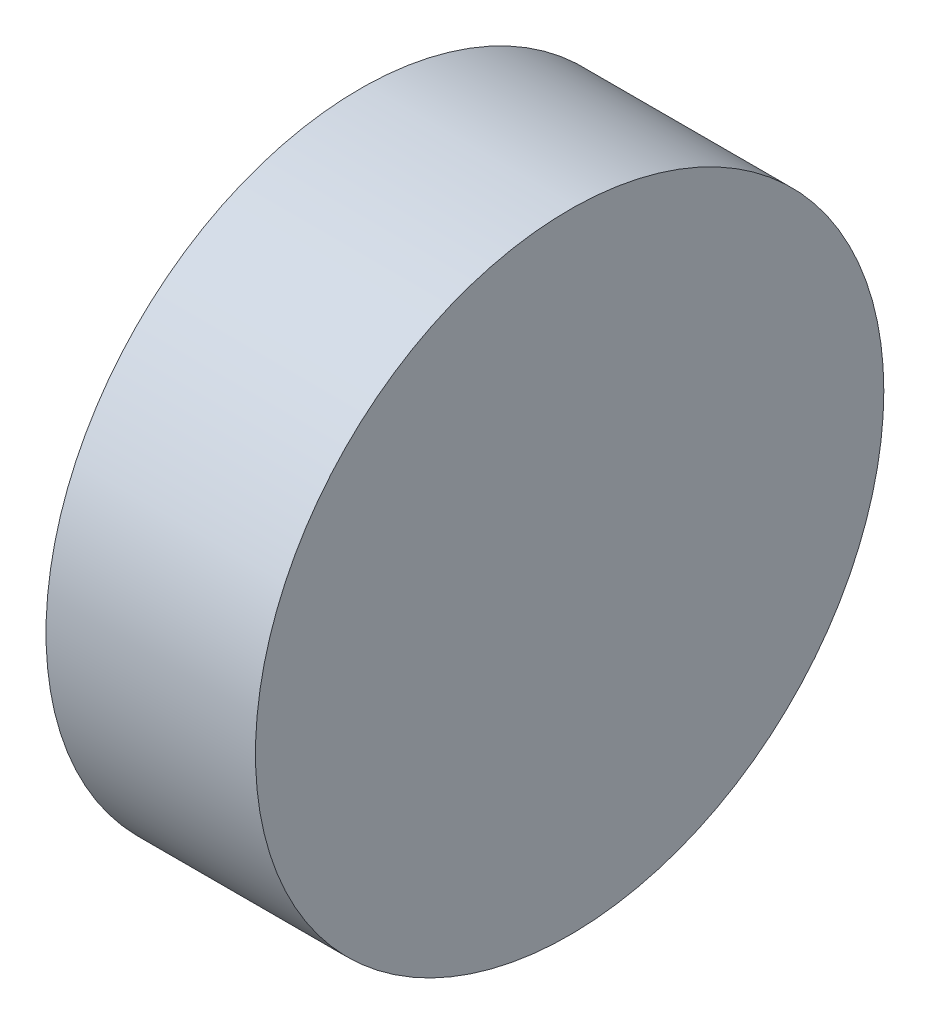
from build123d import *

# Parameters (mm, degrees)
ESBO_O1_R                = 3
RESSALTO_EXTRUS_O1_DEPTH = 2


with BuildPart() as part:
    # Esboço1 → Ressalto-extrusão1 (new body)
    with BuildSketch(Plane(origin=(0, 0, 0), x_dir=(0, 0, -1), z_dir=(1, 0, 0))):
        Circle(ESBO_O1_R)
    extrude(amount=RESSALTO_EXTRUS_O1_DEPTH)


solid = part.part
